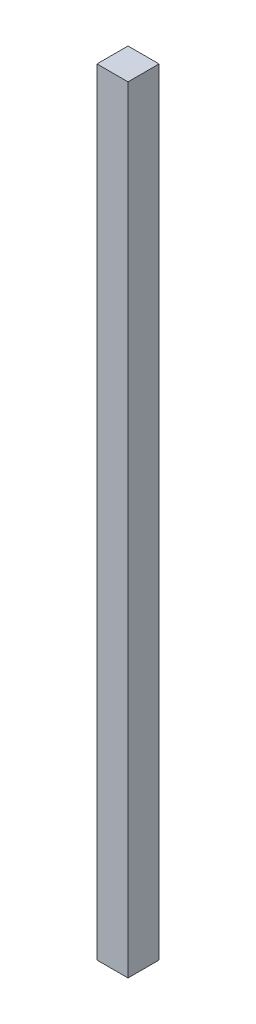
from build123d import *

# Parameters (mm, degrees)
SKETCH1_W           = 20
SKETCH1_H           = 20
BOSS_EXTRUDE1_DEPTH = 250


with BuildPart() as part:
    # Sketch1 → Boss-Extrude1 (new, symmetric)
    with BuildSketch(Plane(origin=(0, 0, 0), x_dir=(1, 0, 0), z_dir=(0, 1, 0))):
        Rectangle(SKETCH1_W, SKETCH1_H)
    extrude(amount=BOSS_EXTRUDE1_DEPTH, both=True)


solid = part.part
